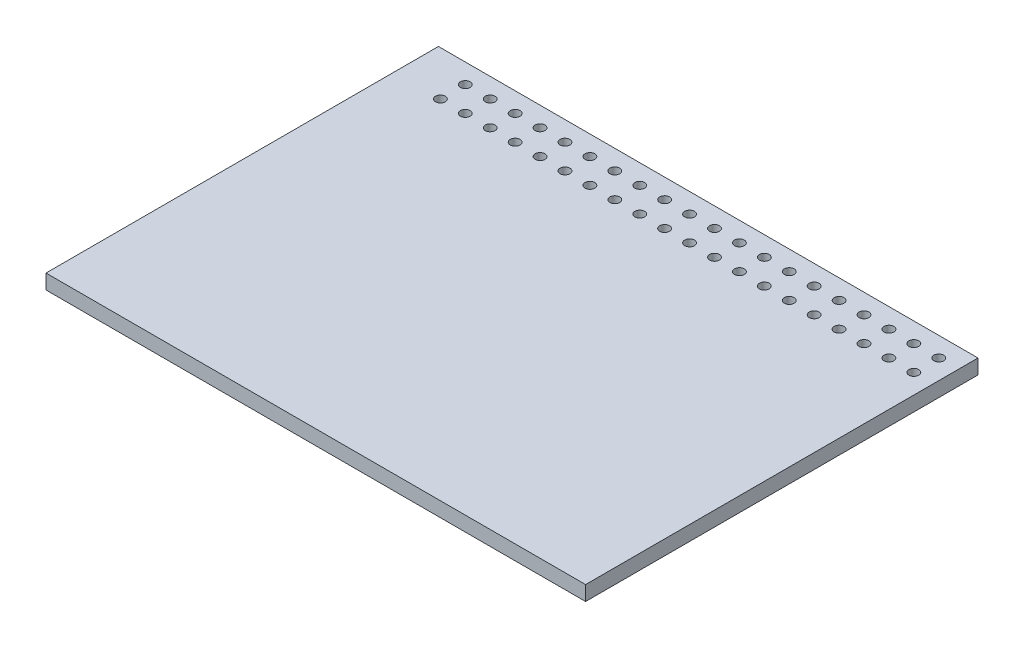
from build123d import *

# Parameters (mm, degrees)
SKETCH1_W           = 55
SKETCH1_H           = 40
SKETCH1_R           = 0.5
BOSS_EXTRUDE1_DEPTH = 1.5


with BuildPart() as part:
    # Sketch1 → Boss-Extrude1 (new body)
    with BuildSketch(Plane(origin=(0, 0, 0), x_dir=(1, 0, 0), z_dir=(0, 1, 0))):
        Rectangle(SKETCH1_W, SKETCH1_H)
        with Locations(Location((25.5, 18, 0), (0, 0, 270))):
            Circle(SKETCH1_R, mode=Mode.SUBTRACT)
        with Locations(Location((22.96, 18, 0), (0, 0, 270))):
            Circle(SKETCH1_R, mode=Mode.SUBTRACT)
        with Locations(Location((20.42, 18, 0), (0, 0, 270))):
            Circle(SKETCH1_R, mode=Mode.SUBTRACT)
        with Locations(Location((17.88, 18, 0), (0, 0, 270))):
            Circle(SKETCH1_R, mode=Mode.SUBTRACT)
        with Locations(Location((15.34, 18, 0), (0, 0, 270))):
            Circle(SKETCH1_R, mode=Mode.SUBTRACT)
        with Locations(Location((12.8, 18, 0), (0, 0, 270))):
            Circle(SKETCH1_R, mode=Mode.SUBTRACT)
        with Locations(Location((10.26, 18, 0), (0, 0, 270))):
            Circle(SKETCH1_R, mode=Mode.SUBTRACT)
        with Locations(Location((7.72, 18, 0), (0, 0, 270))):
            Circle(SKETCH1_R, mode=Mode.SUBTRACT)
        with Locations(Location((5.18, 18, 0), (0, 0, 270))):
            Circle(SKETCH1_R, mode=Mode.SUBTRACT)
        with Locations(Location((2.64, 18, 0), (0, 0, 270))):
            Circle(SKETCH1_R, mode=Mode.SUBTRACT)
        with Locations(Location((0.1, 18, 0), (0, 0, 270))):
            Circle(SKETCH1_R, mode=Mode.SUBTRACT)
        with Locations(Location((-2.44, 18, 0), (0, 0, 270))):
            Circle(SKETCH1_R, mode=Mode.SUBTRACT)
        with Locations(Location((-4.98, 18, 0), (0, 0, 270))):
            Circle(SKETCH1_R, mode=Mode.SUBTRACT)
        with Locations(Location((-7.52, 18, 0), (0, 0, 270))):
            Circle(SKETCH1_R, mode=Mode.SUBTRACT)
        with Locations(Location((-10.06, 18, 0), (0, 0, 270))):
            Circle(SKETCH1_R, mode=Mode.SUBTRACT)
        with Locations(Location((-12.6, 18, 0), (0, 0, 270))):
            Circle(SKETCH1_R, mode=Mode.SUBTRACT)
        with Locations(Location((-15.14, 18, 0), (0, 0, 270))):
            Circle(SKETCH1_R, mode=Mode.SUBTRACT)
        with Locations(Location((-17.68, 18, 0), (0, 0, 270))):
            Circle(SKETCH1_R, mode=Mode.SUBTRACT)
        with Locations(Location((-20.22, 18, 0), (0, 0, 270))):
            Circle(SKETCH1_R, mode=Mode.SUBTRACT)
        with Locations(Location((-22.76, 18, 0), (0, 0, 270))):
            Circle(SKETCH1_R, mode=Mode.SUBTRACT)
        with Locations(Location((22.96, 15.46, 0), (0, 0, 270))):
            Circle(SKETCH1_R, mode=Mode.SUBTRACT)
        with Locations(Location((20.42, 15.46, 0), (0, 0, 270))):
            Circle(SKETCH1_R, mode=Mode.SUBTRACT)
        with Locations(Location((17.88, 15.46, 0), (0, 0, 270))):
            Circle(SKETCH1_R, mode=Mode.SUBTRACT)
        with Locations(Location((15.34, 15.46, 0), (0, 0, 270))):
            Circle(SKETCH1_R, mode=Mode.SUBTRACT)
        with Locations(Location((12.8, 15.46, 0), (0, 0, 270))):
            Circle(SKETCH1_R, mode=Mode.SUBTRACT)
        with Locations(Location((10.26, 15.46, 0), (0, 0, 270))):
            Circle(SKETCH1_R, mode=Mode.SUBTRACT)
        with Locations(Location((7.72, 15.46, 0), (0, 0, 270))):
            Circle(SKETCH1_R, mode=Mode.SUBTRACT)
        with Locations(Location((5.18, 15.46, 0), (0, 0, 270))):
            Circle(SKETCH1_R, mode=Mode.SUBTRACT)
        with Locations(Location((2.64, 15.46, 0), (0, 0, 270))):
            Circle(SKETCH1_R, mode=Mode.SUBTRACT)
        with Locations(Location((0.1, 15.46, 0), (0, 0, 270))):
            Circle(SKETCH1_R, mode=Mode.SUBTRACT)
        with Locations(Location((-2.44, 15.46, 0), (0, 0, 270))):
            Circle(SKETCH1_R, mode=Mode.SUBTRACT)
        with Locations(Location((-4.98, 15.46, 0), (0, 0, 270))):
            Circle(SKETCH1_R, mode=Mode.SUBTRACT)
        with Locations(Location((-7.52, 15.46, 0), (0, 0, 270))):
            Circle(SKETCH1_R, mode=Mode.SUBTRACT)
        with Locations(Location((-10.06, 15.46, 0), (0, 0, 270))):
            Circle(SKETCH1_R, mode=Mode.SUBTRACT)
        with Locations(Location((-12.6, 15.46, 0), (0, 0, 270))):
            Circle(SKETCH1_R, mode=Mode.SUBTRACT)
        with Locations(Location((-15.14, 15.46, 0), (0, 0, 270))):
            Circle(SKETCH1_R, mode=Mode.SUBTRACT)
        with Locations(Location((-17.68, 15.46, 0), (0, 0, 270))):
            Circle(SKETCH1_R, mode=Mode.SUBTRACT)
        with Locations(Location((-20.22, 15.46, 0), (0, 0, 270))):
            Circle(SKETCH1_R, mode=Mode.SUBTRACT)
        with Locations(Location((-22.76, 15.46, 0), (0, 0, 270))):
            Circle(SKETCH1_R, mode=Mode.SUBTRACT)
        with Locations(Location((25.5, 15.46, 0), (0, 0, 270))):
            Circle(SKETCH1_R, mode=Mode.SUBTRACT)
    extrude(amount=BOSS_EXTRUDE1_DEPTH)


solid = part.part
